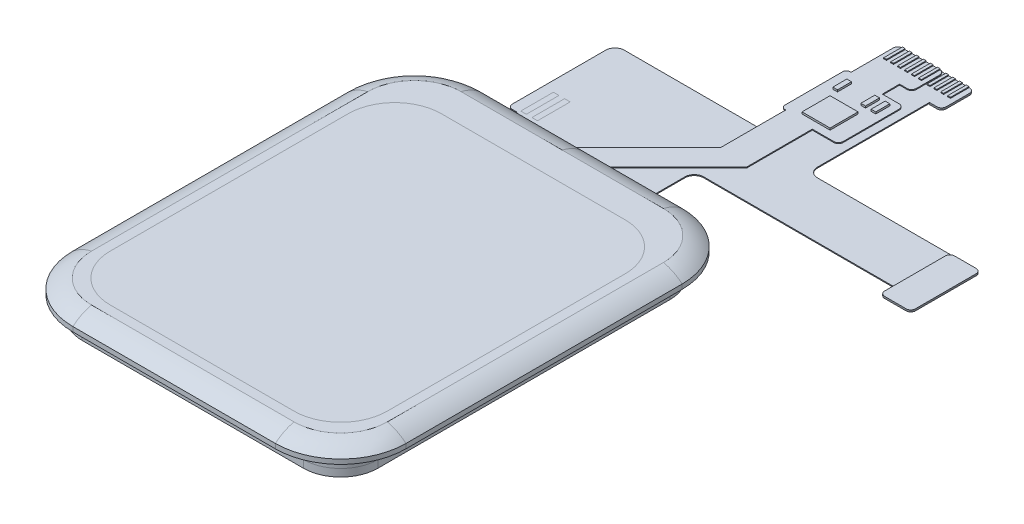
from build123d import *

# Parameters (mm, degrees)
EXTRUDE_1_DEPTH         = 1.5
EXTRUDE_2_DEPTH         = 0.1
EXTRUDE_3_DEPTH         = 1.4
EXTRUDE_4_DEPTH         = 0.8
EXTRUDE_5_DEPTH         = 0.1
EXTRUDE_6_DEPTH         = 0.1
EXTRUDE_7_DEPTH         = 0.1
SKETCH_14_W             = 2
SKETCH_14_H             = 5.5
SKETCH_14_W_2           = 2.5
SKETCH_14_H_2           = 4.9
EXTRUDE_8_DEPTH         = 0.3
SKETCH_15_W             = 0.5
SKETCH_15_H             = 3.8
CUT_EXTRUDE_1_DEPTH     = 0.2
SKETCH_16_W             = 3
SKETCH_16_H             = 3
EXTRUDE_9_DEPTH         = 0.2
SKETCH_16_W_2           = 0.5
SKETCH_16_H_2           = 1.5
EXTRUDE_9_2_DEPTH       = 0.2
EXTRUDE_9_3_DEPTH       = 0.2
EXTRUDE_9_4_DEPTH       = 0.2
EXTRUDE_10_DEPTH        = 0.1
EXTRUDE_10_DEPTH_BACK   = 0.2
SKETCH_17_W             = 0.3
SKETCH_17_H             = 2
EXTRUDE_10_2_DEPTH      = 0.1
EXTRUDE_10_2_DEPTH_BACK = 0.2
EXTRUDE_10_3_DEPTH      = 0.1
EXTRUDE_10_3_DEPTH_BACK = 0.2
EXTRUDE_10_4_DEPTH      = 0.1
EXTRUDE_10_4_DEPTH_BACK = 0.2
EXTRUDE_10_5_DEPTH      = 0.1
EXTRUDE_10_5_DEPTH_BACK = 0.2
EXTRUDE_10_6_DEPTH      = 0.1
EXTRUDE_10_6_DEPTH_BACK = 0.2
SKETCH_20_W             = 0.3
SKETCH_20_H             = 2
EXTRUDE_11_DEPTH        = 0.1
EXTRUDE_11_2_DEPTH      = 0.1
EXTRUDE_11_3_DEPTH      = 0.1
EXTRUDE_11_4_DEPTH      = 0.1
EXTRUDE_11_5_DEPTH      = 0.1
EXTRUDE_11_6_DEPTH      = 0.1
SKETCH_21_W             = 0.6
SKETCH_21_H             = 3
SKETCH_21_W_2           = 1
CUT_EXTRUDE_2_DEPTH     = 0.1
EXTRUDE_12_DEPTH        = 0.1


with BuildPart() as part:
    # 草图1 → 凸台-拉伸1 (new body)
    with BuildSketch(Plane(origin=(0, 0, 0), x_dir=(1, 0, 0), z_dir=(0, 1, 0))):
        with BuildLine():
            Line((7, 0), (28.7, 0))
            ThreePointArc((28.7, 0), (33.649747468, 2.050252532), (35.7, 7))
            Line((35.7, 7), (35.7, 36.6))
            ThreePointArc((35.7, 36.6), (33.649747468, 41.549747468), (28.7, 43.6))
            Line((28.7, 43.6), (7, 43.6))
            ThreePointArc((7, 43.6), (2.050252532, 41.549747468), (0, 36.6))
            Line((0, 36.6), (0, 7))
            ThreePointArc((0, 7), (2.050252532, 2.050252532), (7, 0))
        make_face()
    extrude(amount=EXTRUDE_1_DEPTH)

    # 切除-扫描1: sweep along a path in 草图2
    with BuildLine(Plane(origin=(0, 1.5, 0), x_dir=(1, 0, 0), z_dir=(0, 1, 0))) as sweep_1_path:
        Line((7, 0), (28.7, 0))
        ThreePointArc((28.7, 0), (33.649747468, 2.050252532), (35.7, 7))
        Line((35.7, 7), (35.7, 36.6))
        ThreePointArc((35.7, 36.6), (33.649747468, 41.549747468), (28.7, 43.6))
        Line((28.7, 43.6), (7, 43.6))
        ThreePointArc((7, 43.6), (2.050252532, 41.549747468), (0, 36.6))
        Line((0, 36.6), (0, 7))
        ThreePointArc((0, 7), (2.050252532, 2.050252532), (7, 0))
    # 草图3 → 切除-扫描1 (sweep, cut)
    with BuildSketch(Plane.ZY.offset(-17.85)):
        with BuildLine():
            Line((-43.6, 1.5), (-43.6, 0.5))
            add(Edge.make_bspline(
                [(-43.6, 0.5), (-42.730319451, 1.244639536), (-41.6, 1.5)],
                knots=[0, 0, 0, 1, 1, 1], degree=2))
            Line((-41.6, 1.5), (-43.6, 1.5))
        make_face()
    sweep(path=sweep_1_path.line, mode=Mode.SUBTRACT)


with BuildPart() as body_2:
    # 草图6 → 凸台-拉伸2 (new body)
    with BuildSketch(Plane.XZ):
        with BuildLine():
            Line((6, -2), (29.7, -2))
            ThreePointArc((29.7, -2), (32.528427125, -3.171572875), (33.7, -6))
            Line((33.7, -6), (33.7, -37.3))
            ThreePointArc((33.7, -37.3), (32.528427125, -40.128427125), (29.7, -41.3))
            Line((29.7, -41.3), (6, -41.3))
            ThreePointArc((6, -41.3), (3.171572875, -40.128427125), (2, -37.3))
            Line((2, -37.3), (2, -6))
            ThreePointArc((2, -6), (3.171572875, -3.171572875), (6, -2))
        make_face()
    extrude(amount=EXTRUDE_2_DEPTH)


with BuildPart() as body_3:
    # 草图7 → 凸台-拉伸3 (new body)
    with BuildSketch(Plane.XZ.offset(0.1)):
        with BuildLine():
            Line((33.7, -37.3), (33.7, -6))
            ThreePointArc((33.7, -6), (32.528427125, -3.171572875), (29.7, -2))
            Line((29.7, -2), (6, -2))
            ThreePointArc((6, -2), (3.171572875, -3.171572875), (2, -6))
            Line((2, -6), (2, -37.3))
            ThreePointArc((2, -37.3), (3.171572875, -40.128427125), (6, -41.3))
            Line((6, -41.3), (29.7, -41.3))
            ThreePointArc((29.7, -41.3), (32.528427125, -40.128427125), (33.7, -37.3))
        make_face()
    extrude(amount=EXTRUDE_3_DEPTH)


with BuildPart() as body_4:
    # 草图8 → 凸台-拉伸4 (new body)
    with BuildSketch(Plane.XZ.offset(1.5)):
        with BuildLine():
            Line((33.7, -37.3), (33.7, -6))
            ThreePointArc((33.7, -6), (32.528427125, -3.171572875), (29.7, -2))
            Line((29.7, -2), (6, -2))
            ThreePointArc((6, -2), (3.171572875, -3.171572875), (2, -6))
            Line((2, -6), (2, -37.3))
            ThreePointArc((2, -37.3), (3.171572875, -40.128427125), (6, -41.3))
            Line((6, -41.3), (29.7, -41.3))
            ThreePointArc((29.7, -41.3), (32.528427125, -40.128427125), (33.7, -37.3))
        make_face()
    extrude(amount=EXTRUDE_4_DEPTH)


with BuildPart() as body_5:
    # 草图9 → 凸台-拉伸5 (new body)
    with BuildSketch(Plane.XZ.offset(0.1)):
        with BuildLine():
            Line((27.7, -51.55), (27.7, -58.55))
            Line((27.7, -58.55), (30, -58.55))
            ThreePointArc((30, -58.55), (30.353553391, -58.696446609), (30.5, -59.05))
            Line((30.5, -59.05), (30.5, -65.05))
            ThreePointArc((30.5, -65.05), (30.353553391, -65.403553391), (30, -65.55))
            Line((30, -65.55), (28.2, -65.55))
            Line((28.2, -65.55), (28.2, -67.4))
            Line((28.2, -67.4), (29, -67.4))
            ThreePointArc((29, -67.4), (29.353553391, -67.546446609), (29.5, -67.9))
            Line((29.5, -67.9), (29.5, -70.4))
            ThreePointArc((29.5, -70.4), (29.353553391, -70.753553391), (29, -70.9))
            Line((29, -70.9), (25, -70.9))
            ThreePointArc((25, -70.9), (24.646446609, -70.753553391), (24.5, -70.4))
            Line((24.5, -70.4), (24.5, -65.9))
            Line((24.5, -65.9), (24.4, -65.9))
            ThreePointArc((24.4, -65.9), (24.117157288, -65.782842712), (24, -65.5))
            Line((24, -65.5), (24, -59.3))
            ThreePointArc((24, -59.3), (24.117157288, -59.017157288), (24.4, -58.9))
            Line((24.4, -58.9), (24.5, -58.9))
            Line((24.5, -58.9), (24.5, -51.9))
            Line((24.5, -51.9), (15.9, -43.3))
            Line((15.9, -43.3), (15.9, -42.3))
            ThreePointArc((15.9, -42.3), (15.607106781, -41.592893219), (14.9, -41.3))
            Line((14.9, -41.3), (20.2, -41.3))
            ThreePointArc((20.2, -41.3), (19.492893219, -41.592893219), (19.2, -42.3))
            Line((19.2, -42.3), (19.2, -43.05))
            Line((19.2, -43.05), (27.7, -51.55))
        make_face()
    extrude(amount=EXTRUDE_5_DEPTH)


with BuildPart() as body_6:
    # 草图11 → 凸台-拉伸6 (new body)
    with BuildSketch(Plane(origin=(0, -0.4, 0), x_dir=(-1, 0, 0), z_dir=(0, -1, 0))):
        with BuildLine():
            Line((-10, 41.3), (-10, 44.6))
            Line((-10, 44.6), (-9.5, 44.6))
            ThreePointArc((-9.5, 44.6), (-9.146446609, 44.746446609), (-9, 45.1))
            Line((-9, 45.1), (-9, 55.1))
            ThreePointArc((-9, 55.1), (-9.292893219, 55.807106781), (-10, 56.1))
            Line((-10, 56.1), (-26.5, 56.1))
            ThreePointArc((-26.5, 56.1), (-27.207106781, 56.392893219), (-27.5, 57.1))
            Line((-27.5, 57.1), (-27.5, 70.6))
            ThreePointArc((-27.5, 70.6), (-27.646446609, 70.953553391), (-28, 71.1))
            Line((-28, 71.1), (-32, 71.1))
            ThreePointArc((-32, 71.1), (-32.353553391, 70.953553391), (-32.5, 70.6))
            Line((-32.5, 70.6), (-32.5, 68.1))
            ThreePointArc((-32.5, 68.1), (-32.353553391, 67.746446609), (-32, 67.6))
            Line((-32, 67.6), (-31.2, 67.6))
            Line((-31.2, 67.6), (-31.2, 55.6))
            ThreePointArc((-31.2, 55.6), (-31.492893219, 54.892893219), (-32.2, 54.6))
            Line((-32.2, 54.6), (-49.2, 54.6))
            ThreePointArc((-49.2, 54.6), (-49.553553391, 54.453553391), (-49.7, 54.1))
            Line((-49.7, 54.1), (-49.7, 47.6))
            ThreePointArc((-49.7, 47.6), (-49.553553391, 47.246446609), (-49.2, 47.1))
            Line((-49.2, 47.1), (-46.9, 47.1))
            ThreePointArc((-46.9, 47.1), (-46.546446609, 47.246446609), (-46.4, 47.6))
            Line((-46.4, 47.6), (-46.4, 48.6))
            Line((-46.4, 48.6), (-26, 48.6))
            ThreePointArc((-26, 48.6), (-25.292893219, 48.307106781), (-25, 47.6))
            Line((-25, 47.6), (-25, 41.3))
            Line((-25, 41.3), (-10, 41.3))
        make_face()
    extrude(amount=EXTRUDE_6_DEPTH)

    # 草图21 → 切除-拉伸2 (cut)
    with BuildSketch(Plane.XZ.offset(0.5)):
        with Locations((12.3, -42.8)):
            Rectangle(SKETCH_21_W, SKETCH_21_H)
        with Locations((19.77, -42.8)):
            Rectangle(SKETCH_21_W_2, SKETCH_21_H)
    extrude(amount=-CUT_EXTRUDE_2_DEPTH, mode=Mode.SUBTRACT)


with BuildPart() as body_7:
    # 草图13 → 凸台-拉伸7 (new body)
    with BuildSketch(Plane(origin=(0, -0.4, 0), x_dir=(1, 0, 0), z_dir=(0, 1, 0))):
        with BuildLine():
            Line((46.4, 48.6), (46.4, 54.1))
            ThreePointArc((46.4, 54.1), (46.546446609, 54.453553391), (46.9, 54.6))
            Line((46.9, 54.6), (49.2, 54.6))
            ThreePointArc((49.2, 54.6), (49.553553391, 54.453553391), (49.7, 54.1))
            Line((49.7, 54.1), (49.7, 47.6))
            ThreePointArc((49.7, 47.6), (49.553553391, 47.246446609), (49.2, 47.1))
            Line((49.2, 47.1), (46.9, 47.1))
            ThreePointArc((46.9, 47.1), (46.546446609, 47.246446609), (46.4, 47.6))
            Line((46.4, 47.6), (46.4, 48.6))
        make_face()
    extrude(amount=EXTRUDE_7_DEPTH)


with BuildPart() as body_8:
    # 草图14 → 凸台-拉伸8 (new body)
    with BuildSketch(Plane.XZ.offset(0.5)):
        with Locations((48.05, -50.85)):
            Rectangle(SKETCH_14_W, SKETCH_14_H)
        with Locations((48.05, -50.85)):
            Rectangle(SKETCH_14_W_2, SKETCH_14_H_2)
    extrude(amount=EXTRUDE_8_DEPTH)

    # 草图15 → 切除-拉伸1 (cut)
    with BuildSketch(Plane.XZ.offset(0.8)):
        with Locations((47.8, -50.85)):
            Rectangle(SKETCH_15_W, SKETCH_15_H)
        with Locations((48.3, -50.85)):
            Rectangle(SKETCH_15_W, SKETCH_15_H)
    extrude(amount=-CUT_EXTRUDE_1_DEPTH, mode=Mode.SUBTRACT)


with BuildPart() as body_9:
    # 草图16 → 凸台-拉伸9 (new body)
    with BuildSketch(Plane(origin=(0, -0.1, 0), x_dir=(1, 0, 0), z_dir=(0, 1, 0))):
        with Locations((27.25, 60.9)):
            Rectangle(SKETCH_16_W, SKETCH_16_H)
    extrude(amount=EXTRUDE_9_DEPTH)


with BuildPart() as body_10:
    # 草图16 → Extrude 9 2 (new body)
    with BuildSketch(Plane(origin=(0, -0.1, 0), x_dir=(1, 0, 0), z_dir=(0, 1, 0))):
        with Locations((29.45, 64.1)):
            Rectangle(SKETCH_16_W_2, SKETCH_16_H_2)
    extrude(amount=EXTRUDE_9_2_DEPTH)


with BuildPart() as body_11:
    # 草图16 → Extrude 9 3 (new body)
    with BuildSketch(Plane(origin=(0, -0.1, 0), x_dir=(1, 0, 0), z_dir=(0, 1, 0))):
        with Locations((28.35, 64.1)):
            Rectangle(SKETCH_16_W_2, SKETCH_16_H_2)
    extrude(amount=EXTRUDE_9_3_DEPTH)


with BuildPart() as body_12:
    # 草图16 → Extrude 9 4 (new body)
    with BuildSketch(Plane(origin=(0, -0.1, 0), x_dir=(1, 0, 0), z_dir=(0, 1, 0))):
        with Locations((25.35, 64.1)):
            Rectangle(SKETCH_16_W_2, SKETCH_16_H_2)
    extrude(amount=EXTRUDE_9_4_DEPTH)


with BuildPart() as body_13:
    # 草图17 → 凸台-拉伸10 (new, two sides: drawn at the far end of the back side and taken through both)
    with BuildSketch(Plane(origin=(0, -0.1, 0), x_dir=(1, 0, 0), z_dir=(0, 1, 0)).offset(-EXTRUDE_10_DEPTH_BACK)):
        with Locations((25.9, 69.9)):
            Rectangle(SKETCH_17_W, SKETCH_17_H)
    extrude(amount=EXTRUDE_10_DEPTH + EXTRUDE_10_DEPTH_BACK)


with BuildPart() as body_14:
    # 草图17 → Extrude 10 2 (new, two sides: drawn at the far end of the back side and taken through both)
    with BuildSketch(Plane(origin=(0, -0.1, 0), x_dir=(1, 0, 0), z_dir=(0, 1, 0)).offset(-EXTRUDE_10_2_DEPTH_BACK)):
        with Locations((25.15, 69.9)):
            Rectangle(SKETCH_17_W, SKETCH_17_H)
    extrude(amount=EXTRUDE_10_2_DEPTH + EXTRUDE_10_2_DEPTH_BACK)


with BuildPart() as body_15:
    # 草图17 → Extrude 10 3 (new, two sides: drawn at the far end of the back side and taken through both)
    with BuildSketch(Plane(origin=(0, -0.1, 0), x_dir=(1, 0, 0), z_dir=(0, 1, 0)).offset(-EXTRUDE_10_3_DEPTH_BACK)):
        with Locations((26.65, 69.9)):
            Rectangle(SKETCH_17_W, SKETCH_17_H)
    extrude(amount=EXTRUDE_10_3_DEPTH + EXTRUDE_10_3_DEPTH_BACK)


with BuildPart() as body_16:
    # 草图17 → Extrude 10 4 (new, two sides: drawn at the far end of the back side and taken through both)
    with BuildSketch(Plane(origin=(0, -0.1, 0), x_dir=(1, 0, 0), z_dir=(0, 1, 0)).offset(-EXTRUDE_10_4_DEPTH_BACK)):
        with Locations((27.4, 69.9)):
            Rectangle(SKETCH_17_W, SKETCH_17_H)
    extrude(amount=EXTRUDE_10_4_DEPTH + EXTRUDE_10_4_DEPTH_BACK)


with BuildPart() as body_17:
    # 草图17 → Extrude 10 5 (new, two sides: drawn at the far end of the back side and taken through both)
    with BuildSketch(Plane(origin=(0, -0.1, 0), x_dir=(1, 0, 0), z_dir=(0, 1, 0)).offset(-EXTRUDE_10_5_DEPTH_BACK)):
        with Locations((28.15, 69.9)):
            Rectangle(SKETCH_17_W, SKETCH_17_H)
    extrude(amount=EXTRUDE_10_5_DEPTH + EXTRUDE_10_5_DEPTH_BACK)


with BuildPart() as body_18:
    # 草图17 → Extrude 10 6 (new, two sides: drawn at the far end of the back side and taken through both)
    with BuildSketch(Plane(origin=(0, -0.1, 0), x_dir=(1, 0, 0), z_dir=(0, 1, 0)).offset(-EXTRUDE_10_6_DEPTH_BACK)):
        with Locations((28.9, 69.9)):
            Rectangle(SKETCH_17_W, SKETCH_17_H)
    extrude(amount=EXTRUDE_10_6_DEPTH + EXTRUDE_10_6_DEPTH_BACK)


with BuildPart() as body_19:
    # 草图20 → 凸台-拉伸11 (new body)
    with BuildSketch(Plane(origin=(0, -0.4, 0), x_dir=(1, 0, 0), z_dir=(0, 1, 0))):
        with Locations((28.88, 70.1)):
            Rectangle(SKETCH_20_W, SKETCH_20_H)
    extrude(amount=EXTRUDE_11_DEPTH)


with BuildPart() as body_20:
    # 草图20 → Extrude 11 2 (new body)
    with BuildSketch(Plane(origin=(0, -0.4, 0), x_dir=(1, 0, 0), z_dir=(0, 1, 0))):
        with Locations((28.15, 70.1)):
            Rectangle(SKETCH_20_W, SKETCH_20_H)
    extrude(amount=EXTRUDE_11_2_DEPTH)


with BuildPart() as body_21:
    # 草图20 → Extrude 11 3 (new body)
    with BuildSketch(Plane(origin=(0, -0.4, 0), x_dir=(1, 0, 0), z_dir=(0, 1, 0))):
        with Locations((29.61, 70.1)):
            Rectangle(SKETCH_20_W, SKETCH_20_H)
    extrude(amount=EXTRUDE_11_3_DEPTH)


with BuildPart() as body_22:
    # 草图20 → Extrude 11 4 (new body)
    with BuildSketch(Plane(origin=(0, -0.4, 0), x_dir=(1, 0, 0), z_dir=(0, 1, 0))):
        with Locations((30.34, 70.1)):
            Rectangle(SKETCH_20_W, SKETCH_20_H)
    extrude(amount=EXTRUDE_11_4_DEPTH)


with BuildPart() as body_23:
    # 草图20 → Extrude 11 5 (new body)
    with BuildSketch(Plane(origin=(0, -0.4, 0), x_dir=(1, 0, 0), z_dir=(0, 1, 0))):
        with Locations((31.07, 70.1)):
            Rectangle(SKETCH_20_W, SKETCH_20_H)
    extrude(amount=EXTRUDE_11_5_DEPTH)


with BuildPart() as body_24:
    # 草图20 → Extrude 11 6 (new body)
    with BuildSketch(Plane(origin=(0, -0.4, 0), x_dir=(1, 0, 0), z_dir=(0, 1, 0))):
        with Locations((31.8, 70.1)):
            Rectangle(SKETCH_20_W, SKETCH_20_H)
    extrude(amount=EXTRUDE_11_6_DEPTH)


with BuildPart() as body_25:
    # 草图23 → 凸台-拉伸12 (new body)
    with BuildSketch(Plane.XZ.offset(0.5)):
        with BuildLine():
            Line((31.2, -67.6), (28, -67.6))
            ThreePointArc((28, -67.6), (27.646446609, -67.746446609), (27.5, -68.1))
            Line((27.5, -68.1), (27.5, -70.6))
            ThreePointArc((27.5, -70.6), (27.646446609, -70.953553391), (28, -71.1))
            Line((28, -71.1), (32, -71.1))
            ThreePointArc((32, -71.1), (32.353553391, -70.953553391), (32.5, -70.6))
            Line((32.5, -70.6), (32.5, -68.1))
            ThreePointArc((32.5, -68.1), (32.353553391, -67.746446609), (32, -67.6))
            Line((32, -67.6), (31.2, -67.6))
        make_face()
    extrude(amount=EXTRUDE_12_DEPTH)


solid = Compound([part.part, body_2.part, body_3.part, body_4.part, body_5.part, body_6.part, body_7.part, body_8.part, body_9.part, body_10.part, body_11.part, body_12.part, body_13.part, body_14.part, body_15.part, body_16.part, body_17.part, body_18.part, body_19.part, body_20.part, body_21.part, body_22.part, body_23.part, body_24.part, body_25.part])
